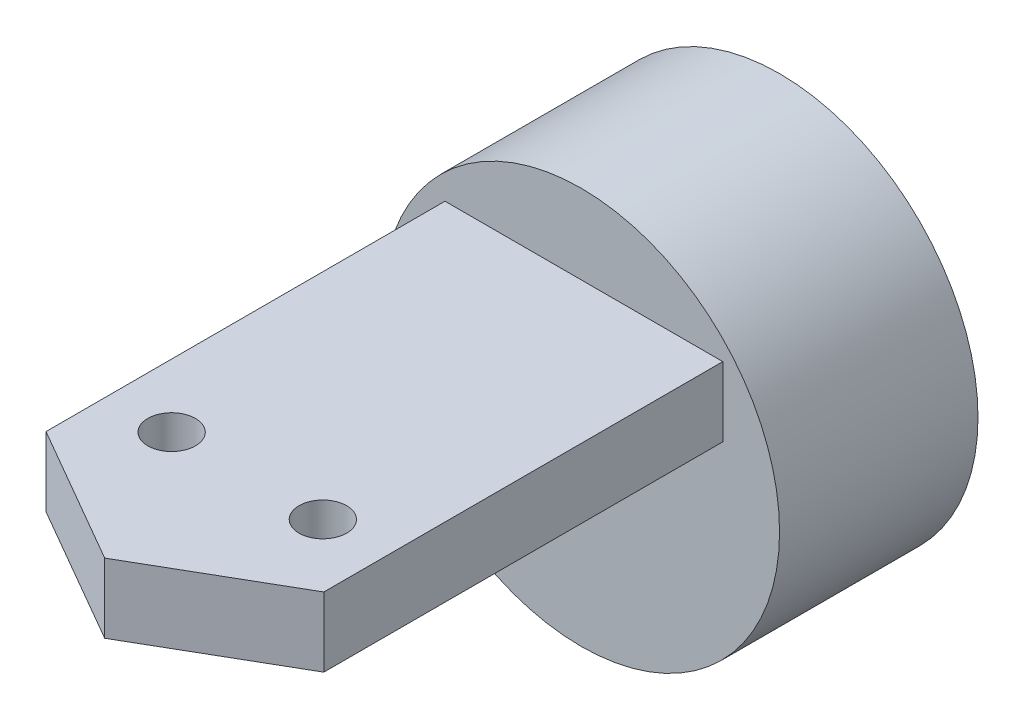
from build123d import *

# Parameters (mm, degrees)
CROQUIS1_R              = 15
SALIENTE_EXTRUIR1_DEPTH = 10
CROQUIS2_R              = 2.5
SALIENTE_EXTRUIR3_DEPTH = 5
CROQUIS3_W              = 27.214568237
CROQUIS3_H              = 3.5
SALIENTE_EXTRUIR5_DEPTH = 30
REDONDEO1_SIZE          = 10
REDONDEO2_SIZE          = 10
CROQUIS4_R              = 1.2
CORTAR_EXTRUIR7_DEPTH   = 30
CORTAR_EXTRUIR8_DEPTH   = 30
CORTAR_EXTRUIR9_START   = -30
CROQUIS8_R              = 15
CROQUIS8_R_2            = 10
CORTAR_EXTRUIR9_DEPTH   = 30
CROQUIS9_R              = 1.239789427
CROQUIS9_R_2            = 1.228877731
SALIENTE_EXTRUIR6_DEPTH = 3.5
CROQUIS10_R             = 1.2
CORTAR_EXTRUIR11_DEPTH  = 3.5


with BuildPart() as part:
    # Croquis1 → Saliente-Extruir1 (new body)
    with BuildSketch(Plane.XY):
        Circle(CROQUIS1_R)
    extrude(amount=SALIENTE_EXTRUIR1_DEPTH)

    # Croquis2 → Saliente-Extruir3 (add)
    with BuildSketch(Plane(origin=(0, 0, 0), x_dir=(-1, 0, 0), z_dir=(0, 0, -1))):
        Circle(CROQUIS2_R)
    extrude(amount=SALIENTE_EXTRUIR3_DEPTH)

    # Croquis3 → Saliente-Extruir5 (add)
    with BuildSketch(Plane.XY.offset(10)):
        with Locations((0.140442967, 4.25)):
            Rectangle(CROQUIS3_W, CROQUIS3_H)
    extrude(amount=SALIENTE_EXTRUIR5_DEPTH)

    # Redondeo1
    redondeo1_edges = [part.edges().sort_by_distance(p)[0] for p in [
        (13.747727085, 4.25, 40),
    ]]
    chamfer(redondeo1_edges, length=REDONDEO1_SIZE)

    # Redondeo2
    redondeo2_edges = [part.edges().sort_by_distance(p)[0] for p in [
        (-13.466841152, 4.25, 40),
    ]]
    chamfer(redondeo2_edges, length=REDONDEO2_SIZE)

    # Croquis4 → Cortar-Extruir7 (cut)
    with BuildSketch(Plane(origin=(0, 6, 0), x_dir=(1, 0, 0), z_dir=(0, 1, 0))):
        with Locations(Location((-2.669557034, -26.064684959, 0), (0, 0, 270))):
            Circle(CROQUIS4_R)
        with Locations(Location((2.950442966, -26.064684959, 0), (0, 0, 270))):
            Circle(CROQUIS4_R)
    extrude(amount=-CORTAR_EXTRUIR7_DEPTH, mode=Mode.SUBTRACT)

    # Croquis7 → Cortar-Extruir8 (cut)
    with BuildSketch(Plane(origin=(0, 6, 0), x_dir=(1, 0, 0), z_dir=(0, 1, 0))):
        Polygon((-6.859557034, -30.106136843), (-6.859557034, -22.023233074), (-6.859557034, -10), (-13.466841152, -10), (-13.466841152, -30), (-3.466841152, -40), (3.747727085, -40), (13.747727085, -30), (13.747727085, -10), (7.140442966, -10), (7.140442966, -22.023233074), (7.140442966, -30.106136843), (0.140442966, -34.147588727), align=None)
    extrude(amount=-CORTAR_EXTRUIR8_DEPTH, mode=Mode.SUBTRACT)

    # Croquis8 → Cortar-Extruir9 (cut)
    with BuildSketch(Plane.XY.offset(10).offset(CORTAR_EXTRUIR9_START)):
        Circle(CROQUIS8_R)
        Circle(CROQUIS8_R_2, mode=Mode.SUBTRACT)
    extrude(amount=CORTAR_EXTRUIR9_DEPTH, mode=Mode.SUBTRACT)

    # Croquis9 → Saliente-Extruir6 (add)
    with BuildSketch(Plane(origin=(0, 6, 0), x_dir=(1, 0, 0), z_dir=(0, 1, 0))):
        with Locations((-2.669557034, -26.064684959)):
            Circle(CROQUIS9_R)
        with Locations((2.950442966, -26.064684959)):
            Circle(CROQUIS9_R_2)
    extrude(amount=-SALIENTE_EXTRUIR6_DEPTH)

    # Croquis10 → Cortar-Extruir11 (cut)
    with BuildSketch(Plane(origin=(0, 6, 0), x_dir=(1, 0, 0), z_dir=(0, 1, 0))):
        with Locations(Location((-3.669557034, -26.965113623, 0), (0, 0, 270))):
            Circle(CROQUIS10_R)
        with Locations(Location((3.950442966, -26.965113623, 0), (0, 0, 90))):
            Circle(CROQUIS10_R)
    extrude(amount=-CORTAR_EXTRUIR11_DEPTH, mode=Mode.SUBTRACT)


solid = part.part
